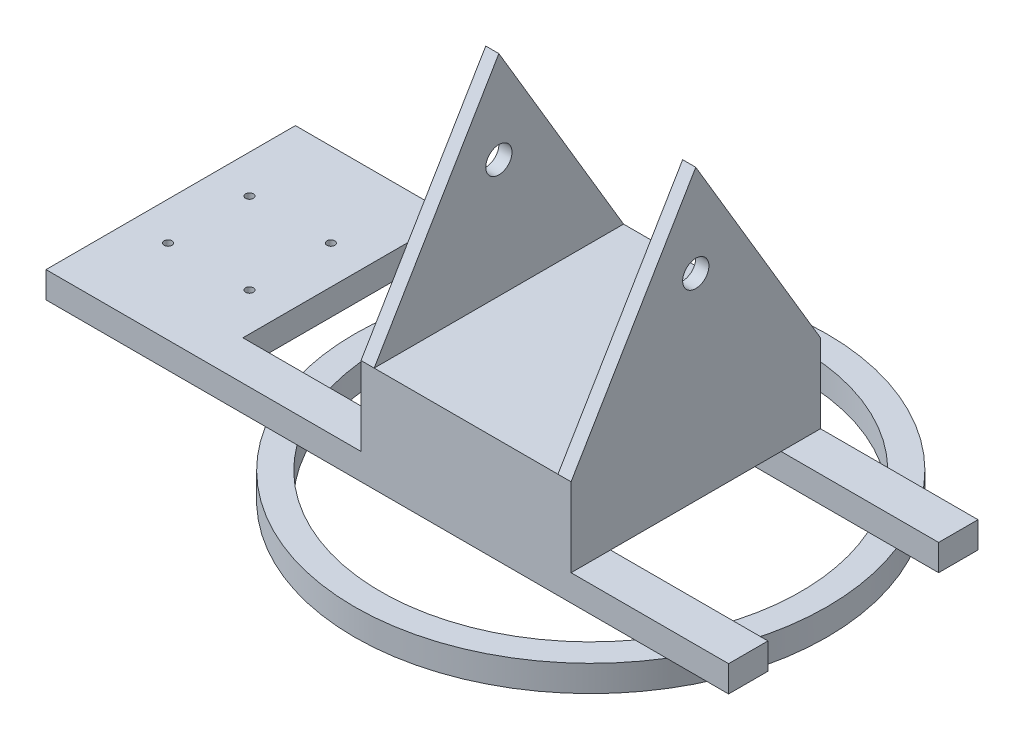
from build123d import *

# Parameters (mm, degrees)
SKETCH1_R           = 90
SKETCH1_R_2         = 80
BOSS_EXTRUDE1_DEPTH = 10
SKETCH2_R           = 2.5
SKETCH3_W           = 200
SKETCH3_H           = 15
BOSS_EXTRUDE2_DEPTH = 10
SKETCH5_W           = 60
SKETCH5_H           = 95
SKETCH5_R           = 1.5
BOSS_EXTRUDE3_DEPTH = 10
SKETCH7_W           = 44.3
SKETCH7_H           = 44.3
SKETCH7_W_2         = 42.3
SKETCH7_H_2         = 42.3
BOSS_EXTRUDE4_DEPTH = 5
SKETCH8_W           = 95
SKETCH8_H           = 30
BOSS_EXTRUDE5_DEPTH = 35
BOSS_EXTRUDE7_DEPTH = 5
SKETCH10_R          = 5
CUT_EXTRUDE1_DEPTH  = 212.187120819


with BuildPart() as part:
    # Sketch1 → Boss-Extrude1 (new body)
    with BuildSketch(Plane(origin=(0, 0, 0), x_dir=(1, 0, 0), z_dir=(0, 1, 0))):
        with Locations(Location((0, 0, 0), (0, 0, 270))):
            Circle(SKETCH1_R)
        with Locations(Location((0, 0, 0), (0, 0, 270))):
            Circle(SKETCH1_R_2, mode=Mode.SUBTRACT)
    extrude(amount=BOSS_EXTRUDE1_DEPTH)

    # Sketch2 → Cut-Revolve1 (revolve, cut)
    with BuildSketch(Plane.XY, mode=Mode.PRIVATE) as cut_revolve1_sk:
        with Locations((-85, 0)):
            Circle(SKETCH2_R)
    revolve(cut_revolve1_sk.sketch.rotate(Axis((0, 0, 0), (0, 1, 0)), 270), axis=Axis((0, 0, 0), (0, 1, 0)), mode=Mode.SUBTRACT)

    # Sketch3 → Boss-Extrude2 (add)
    with BuildSketch(Plane(origin=(0, 10, 0), x_dir=(1, 0, 0), z_dir=(0, 1, 0))):
        with Locations((0, -40)):
            Rectangle(SKETCH3_W, SKETCH3_H)
        with Locations((0, 40)):
            Rectangle(SKETCH3_W, SKETCH3_H)
    extrude(amount=BOSS_EXTRUDE2_DEPTH)

    # Sketch5 → Boss-Extrude3 (add)
    with BuildSketch(Plane.XZ.offset(-10)):
        with Locations((-130, 0)):
            Rectangle(SKETCH5_W, SKETCH5_H)
        with Locations(Location((-145.5, -15.5, 0), (0, 0, 270))):
            Circle(SKETCH5_R, mode=Mode.SUBTRACT)
        with Locations(Location((-114.5, -15.5, 0), (0, 0, 270))):
            Circle(SKETCH5_R, mode=Mode.SUBTRACT)
        with Locations(Location((-114.5, 15.5, 0), (0, 0, 270))):
            Circle(SKETCH5_R, mode=Mode.SUBTRACT)
        with Locations(Location((-145.5, 15.5, 0), (0, 0, 270))):
            Circle(SKETCH5_R, mode=Mode.SUBTRACT)
    extrude(amount=-BOSS_EXTRUDE3_DEPTH)

    # Sketch7 → Boss-Extrude4 (add)
    with BuildSketch(Plane.XZ.offset(-10)):
        with Locations((-130, 0)):
            Rectangle(SKETCH7_W, SKETCH7_H)
        with Locations((-130, 0)):
            Rectangle(SKETCH7_W_2, SKETCH7_H_2, mode=Mode.SUBTRACT)
    extrude(amount=BOSS_EXTRUDE4_DEPTH)

    # Sketch8 → Boss-Extrude5 (add, symmetric)
    with BuildSketch(Plane(origin=(0, 0, 0), x_dir=(0, 0, -1), z_dir=(1, 0, 0))):
        with Locations((0, 35)):
            Rectangle(SKETCH8_W, SKETCH8_H)
    extrude(amount=BOSS_EXTRUDE5_DEPTH, both=True)

    # Sketch9 → Boss-Extrude7 (add)
    with BuildSketch(Plane.ZY.offset(35)):
        Polygon((-47.5, 50), (0, 130), (47.5, 50), (47.5, 20), (-47.5, 20), align=None)
    boss_extrude7 = extrude(amount=BOSS_EXTRUDE7_DEPTH)

    # Mirror1: Boss-Extrude7 across plane
    add(boss_extrude7.mirror(Plane(origin=(0, 0, 0), x_dir=(0, 0, 1), z_dir=(1, 0, 0))))

    # Sketch10 → Cut-Extrude1 (cut, through all)
    with BuildSketch(Plane.ZY.offset(40)):
        with Locations(Location((0, 95, 0), (0, 0, 180))):
            Circle(SKETCH10_R)
    extrude(amount=-CUT_EXTRUDE1_DEPTH, mode=Mode.SUBTRACT)


solid = part.part
